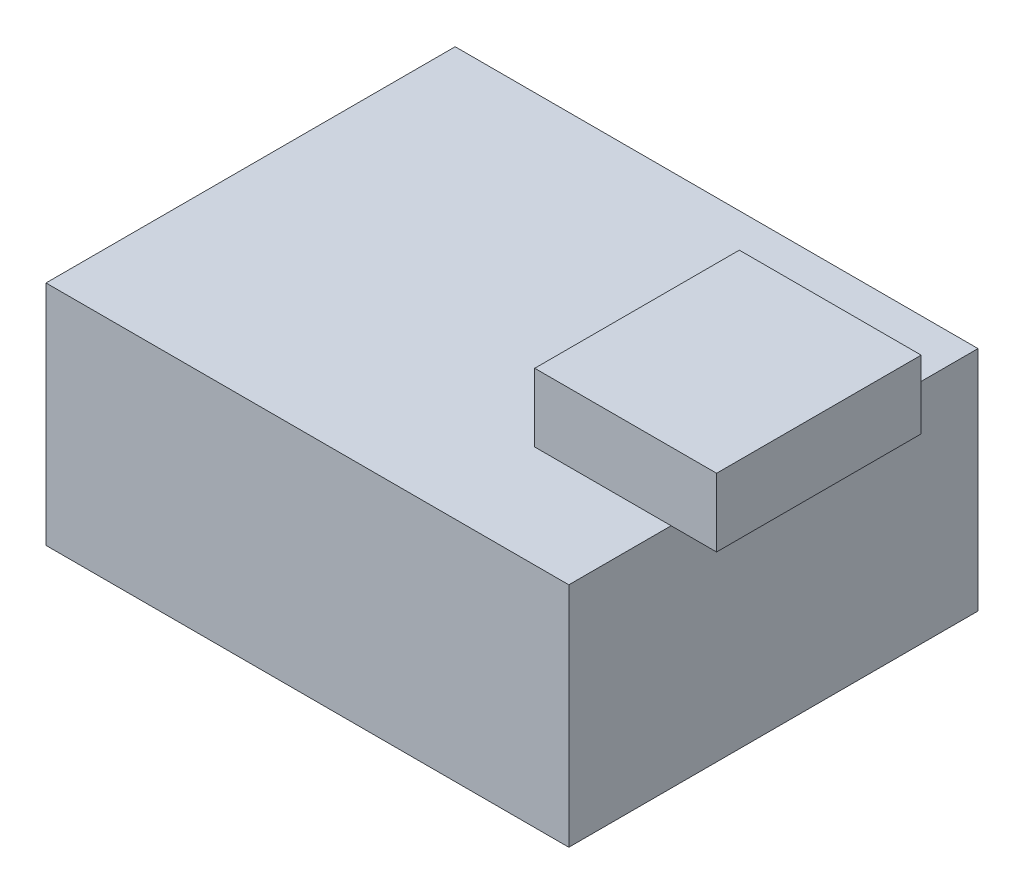
from build123d import *

# Parameters (mm, degrees)
SKETCH_1_W      = 23
SKETCH_1_H      = 18
EXTRUDE_1_DEPTH = 10
SKETCH_2_W      = 8
SKETCH_2_H      = 9
EXTRUDE_2_DEPTH = 3


with BuildPart() as part:
    # 草图1 → 凸台-拉伸1 (new body)
    with BuildSketch(Plane(origin=(0, 0, 0), x_dir=(1, 0, 0), z_dir=(0, 1, 0))):
        with Locations((11.5, 9)):
            Rectangle(SKETCH_1_W, SKETCH_1_H)
    extrude(amount=EXTRUDE_1_DEPTH)

    # 草图2 → 凸台-拉伸2 (add)
    with BuildSketch(Plane(origin=(0, 10, 0), x_dir=(1, 0, 0), z_dir=(0, 1, 0))):
        with Locations((21, 9)):
            Rectangle(SKETCH_2_W, SKETCH_2_H)
    extrude(amount=EXTRUDE_2_DEPTH)


solid = part.part
